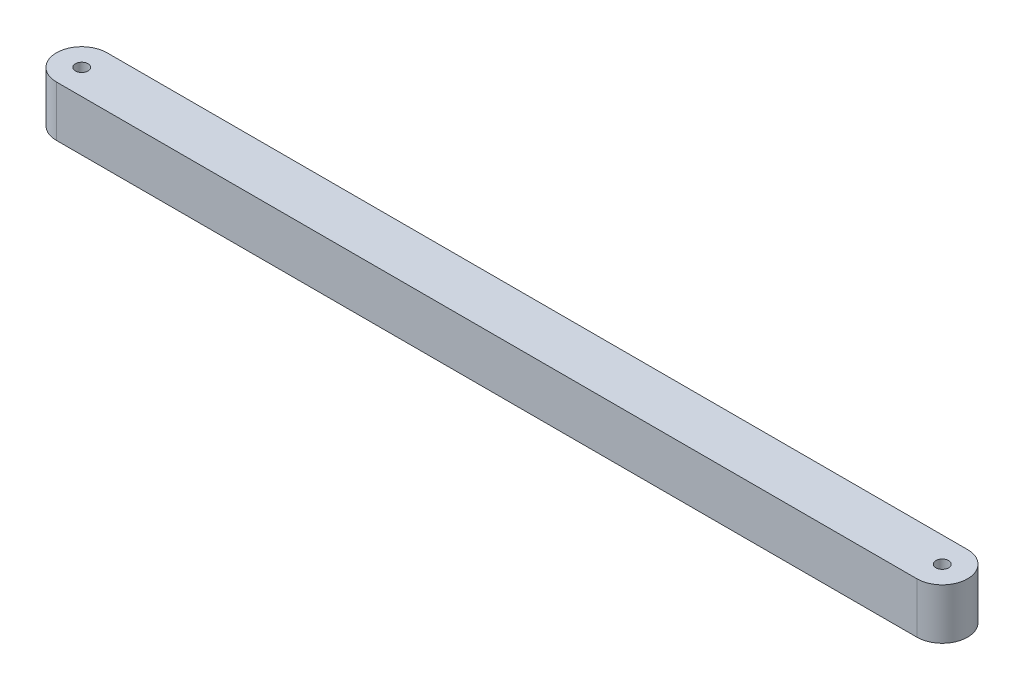
from build123d import *

# Parameters (mm, degrees)
SKETCH1_W                  = 863.6
SKETCH1_H                  = 50.8
BOSS_EXTRUDE2_DEPTH        = 50.8
F_1_2_0_5_DIAMETER_HOLE1_D = 12.7


with BuildPart() as part:
    # Sketch1 → Boss-Extrude2 (new body)
    with BuildSketch(Plane(origin=(0, 0, 0), x_dir=(1, 0, 0), z_dir=(0, 1, 0))):
        with BuildLine():
            Line((-431.8, -25.4), (-431.8, 25.4))
            ThreePointArc((-431.8, 25.4), (-457.2, 0), (-431.8, -25.4))
        make_face()
        Rectangle(SKETCH1_W, SKETCH1_H)
        with BuildLine():
            ThreePointArc((431.8, 25.4), (457.2, 0), (431.8, -25.4))
            Line((431.8, -25.4), (431.8, 25.4))
        make_face()
    extrude(amount=BOSS_EXTRUDE2_DEPTH)

    # 1/2 (0.5) Diameter Hole1 (through all)
    with Locations(Plane(origin=(0, 50.8, 0), x_dir=(1, 0, 0), z_dir=(0, 1, 0))):
        with Locations((431.8, 0), (-431.8, 0)):
            Hole(F_1_2_0_5_DIAMETER_HOLE1_D / 2)


solid = part.part
